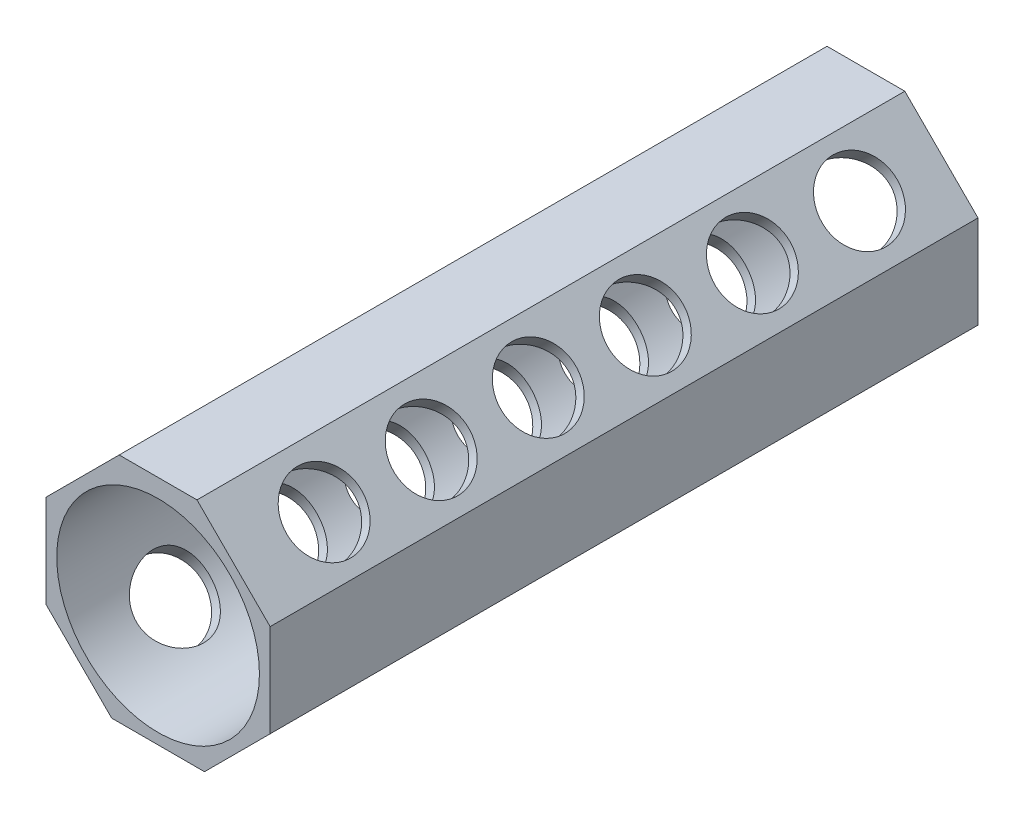
from build123d import *

# Parameters (mm, degrees)
SKIZZE1_R                       = 9.45
AUFSATZ_LINEAR_AUSTRAGEN1_DEPTH = 66
SKIZZE9_R                       = 3.5
SCHNITT_LINEAR_AUSTRAGEN8_DEPTH = 71.657475281


with BuildPart() as part:
    # Skizze1 → Aufsatz-Linear austragen1 (new body)
    with BuildSketch(Plane(origin=(0, 0, 0), x_dir=(0, 1, 0), z_dir=(0, 0, 1))):
        Polygon((11.150811659, 3.627720068), (11.150811659, -3.627720068), (4.328531727, -10.45), (-4.328531727, -10.45), (-10.45, -4.328531727), (-10.45, 4.328531727), (-4.328531727, 10.45), (4.328531727, 10.45), align=None)
        with Locations(Location((0, 0, 0), (0, 0, 270))):
            Circle(SKIZZE1_R, mode=Mode.SUBTRACT)
    extrude(amount=AUFSATZ_LINEAR_AUSTRAGEN1_DEPTH)

    # Skizze9 → Schnitt-Linear austragen8 (cut, through all)
    with BuildSketch(Plane(origin=(7.389265863, 7.389265863, 0), x_dir=(-0.7071067811865476, 0.7071067811865475, 0), z_dir=(0.7071067811865475, 0.7071067811865476, 0))):
        with Locations((0.432478845, 57.6)):
            Circle(SKIZZE9_R)
        with Locations((0.456584688, 47.600029055)):
            Circle(SKIZZE9_R)
        with Locations((0.480690531, 37.600058109)):
            Circle(SKIZZE9_R)
        with Locations((0.504796374, 27.600087164)):
            Circle(SKIZZE9_R)
        with Locations((0.528902217, 17.600116219)):
            Circle(SKIZZE9_R)
        with Locations((0.553008059, 7.600145273)):
            Circle(SKIZZE9_R)
    extrude(amount=-SCHNITT_LINEAR_AUSTRAGEN8_DEPTH, mode=Mode.SUBTRACT)


solid = part.part
